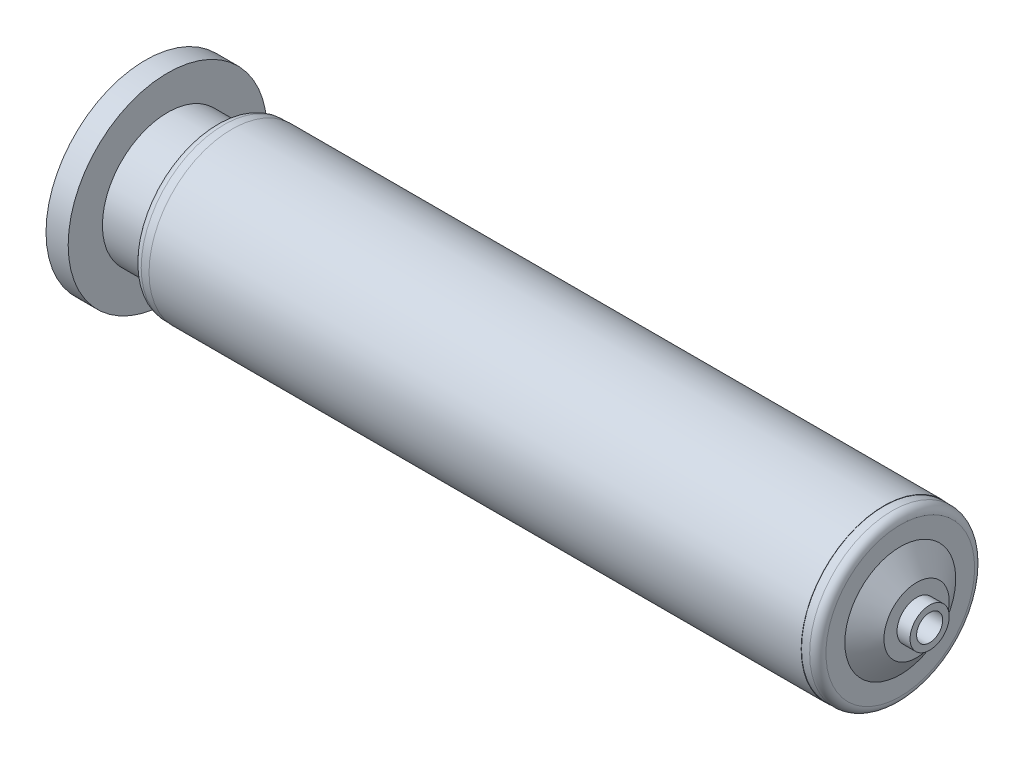
from build123d import *

# Parameters (mm, degrees)
CUT_EXTRUDE1_DEPTH      = 135.59847696
CUT_EXTRUDE1_DEPTH_BACK = 135.59847696
SKETCH3_R               = 4
FILLET1_R               = 2.5


with BuildPart() as part:
    # Sketch1 → Revolve1 (revolve)
    with BuildSketch(Plane(origin=(0, 0, 0), x_dir=(1, 0, 0), z_dir=(0, 1, 0))):
        Polygon((-127.5, 0), (127.5, 0), (127.5, -6), (123.5, -6), (123.5, -10), (118.5, -17), (118.5, -25.3), (113.5, -25.3), (113.5, -25.4), (-86.5, -25.4), (-86.5, -25.3), (-91.5, -25.3), (-91.5, -20), (-106.2, -20), (-106.2, -30.5), (-113, -30.5), (-113, -18.75), (-118.5, -18.75), (-118.5, -17), (-123.5, -10), (-123.5, -6), (-127.5, -6), align=None)
    revolve(axis=Axis((-127.5, 0, 0), (1, 0, 0)))

    # Sketch3 → Cut-Extrude1 (cut, two sides: drawn at the far end of the back side and taken through both)
    with BuildSketch(Plane(origin=(0, 0, 0), x_dir=(0, 0, -1), z_dir=(1, 0, 0)).offset(-CUT_EXTRUDE1_DEPTH_BACK)):
        Circle(SKETCH3_R)
    extrude(amount=CUT_EXTRUDE1_DEPTH + CUT_EXTRUDE1_DEPTH_BACK, mode=Mode.SUBTRACT)

    # Fillet1
    fillet1_edges = [part.edges().sort_by_distance(p)[0] for p in [
        (-91.5, 0, -25.3),
        (118.5, 0, -25.3),
    ]]
    fillet(fillet1_edges, radius=FILLET1_R)


solid = part.part
